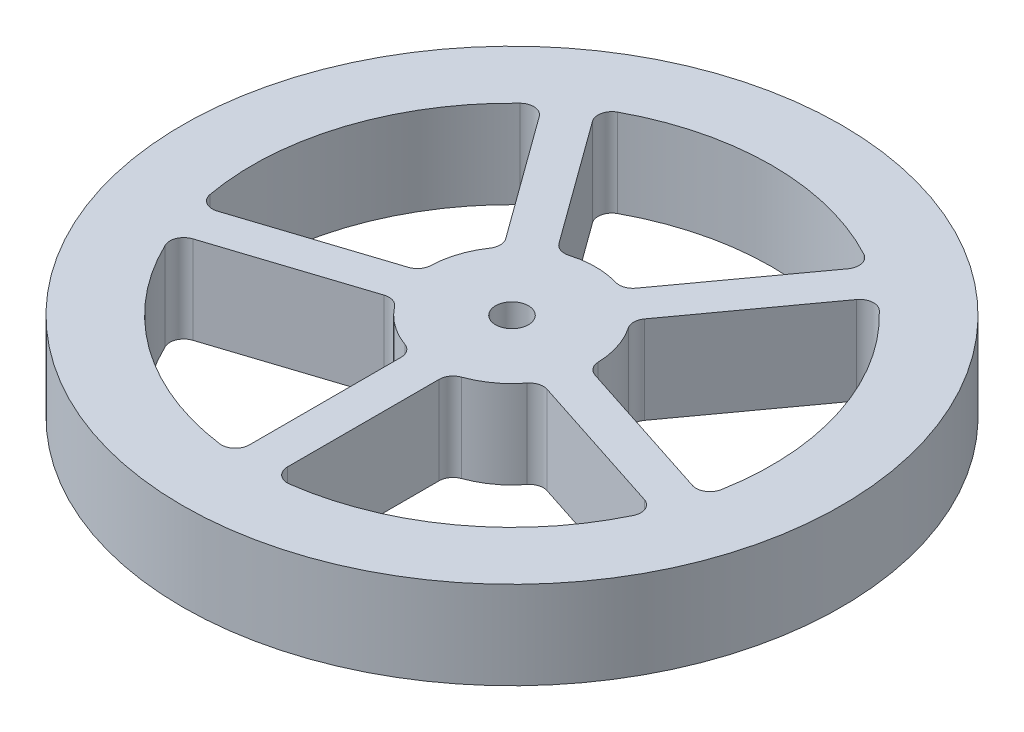
from build123d import *

# Parameters (mm, degrees)
SKETCH1_R           = 30
SKETCH1_R_2         = 1.5
BOSS_EXTRUDE1_DEPTH = 8
SKETCH2_R           = 23.65
SKETCH2_R_2         = 7.62
CUT_EXTRUDE1_DEPTH  = 8
BOSS_EXTRUDE2_DEPTH = 8
CIRPATTERN1_COUNT   = 5


with BuildPart() as part:
    # Sketch1 → Boss-Extrude1 (new body)
    with BuildSketch(Plane(origin=(0, 0, 0), x_dir=(1, 0, 0), z_dir=(0, 1, 0))):
        with Locations(Location((0, 0, 0), (0, 0, 270))):
            Circle(SKETCH1_R)
        with Locations(Location((0, 0, 0), (0, 0, 270))):
            Circle(SKETCH1_R_2, mode=Mode.SUBTRACT)
    extrude(amount=BOSS_EXTRUDE1_DEPTH)

    # Sketch2 → Cut-Extrude1 (cut)
    with BuildSketch(Plane(origin=(0, 8, 0), x_dir=(1, 0, 0), z_dir=(0, 1, 0))):
        with Locations(Location((0, 0, 0), (0, 0, 270))):
            Circle(SKETCH2_R)
        with Locations(Location((0, 0, 0), (0, 0, 270))):
            Circle(SKETCH2_R_2, mode=Mode.SUBTRACT)
    extrude(amount=-CUT_EXTRUDE1_DEPTH, mode=Mode.SUBTRACT)


with BuildPart() as cut_extrude1_piece_1:
    # of the separate pieces the step leaves, piece 1, a body of its own (cut_extrude1_pieces)
    add(part.part.solids().sort_by_distance((0, 0, 30))[0])



with BuildPart() as cut_extrude1_piece_2:
    # of the separate pieces the step leaves, piece 2, a body of its own (cut_extrude1_pieces)
    add(part.part.solids().sort_by_distance((0, 0, 7.62))[0])


with BuildPart() as cut_extrude1_piece_1_1:
    add(cut_extrude1_piece_1.part)

    add(cut_extrude1_piece_2.part)  # Boss-Extrude2 merges Cut-Extrude1 piece 2
    # Sketch3 → Boss-Extrude2 (add)
    with BuildSketch(Plane(origin=(0, 8, 0), x_dir=(1, 0, 0), z_dir=(0, 1, 0))):
        with BuildLine():
            Line((-1.734503171, -8.366902694), (-1.734503171, -22.177406537))
            ThreePointArc((-1.734503171, -22.177406537), (-2.16892881, -23.133814131), (-3.175, -23.435909946))
            ThreePointArc((-3.175, -23.435909946), (0, -23.65), (3.175, -23.435909946))
            ThreePointArc((3.175, -23.435909946), (2.16892881, -23.133814131), (1.734503171, -22.177406537))
            Line((1.734503171, -22.177406537), (1.734503171, -8.366902694))
            ThreePointArc((1.734503171, -8.366902694), (1.965753269, -7.636219014), (2.575288432, -7.171630881))
            ThreePointArc((2.575288432, -7.171630881), (0, -7.62), (-2.575288432, -7.171630881))
            ThreePointArc((-2.575288432, -7.171630881), (-1.965753269, -7.636219014), (-1.734503171, -8.366902694))
        make_face()
    boss_extrude2 = extrude(amount=-BOSS_EXTRUDE2_DEPTH)

    # CirPattern1: Boss-Extrude2 ×5 about axis
    cirpattern1_axis = Axis((0, 0, 0), (0, 1, 0))
    for i in range(1, CIRPATTERN1_COUNT):
        add(boss_extrude2.rotate(cirpattern1_axis, i * 360 / CIRPATTERN1_COUNT))


solid = cut_extrude1_piece_1_1.part
